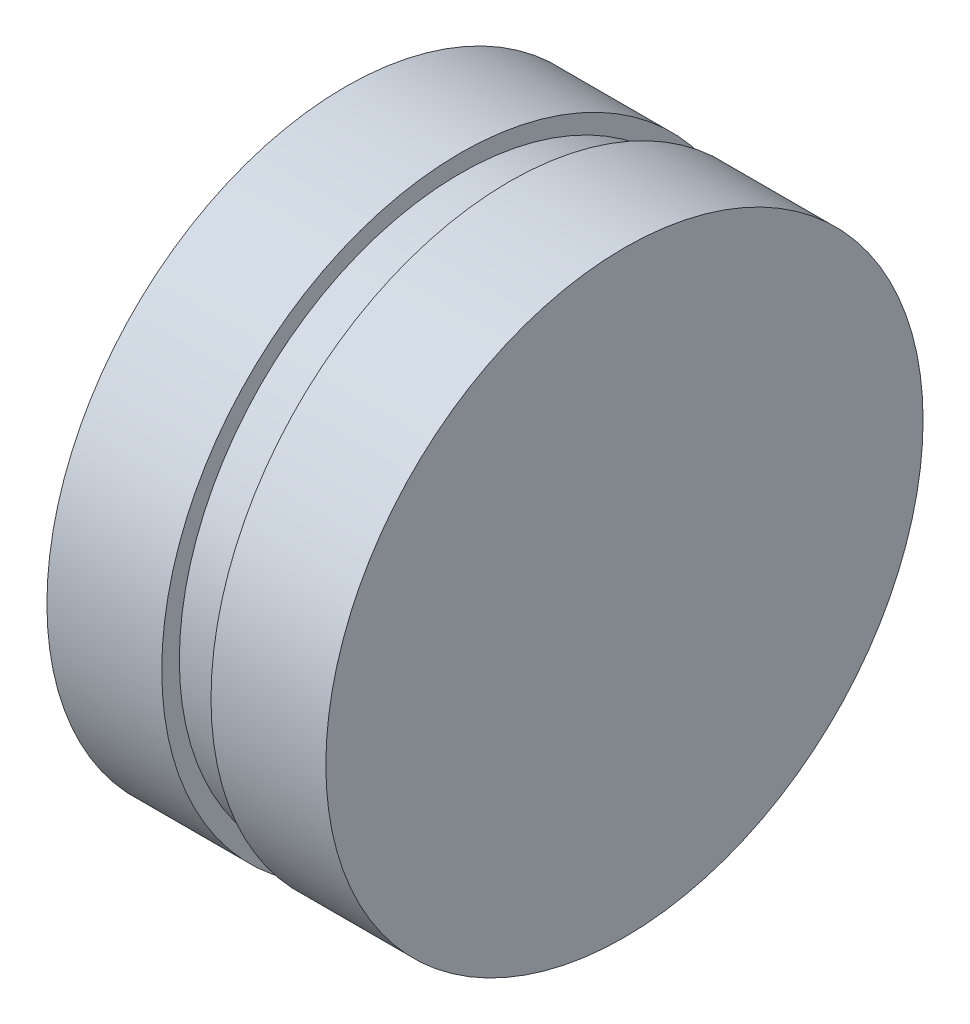
from build123d import *

# Parameters (mm, degrees)
SKETCH8_R           = 21.5646
BOSS_EXTRUDE1_DEPTH = 20.1422
SKETCH9_W           = 3.556
SKETCH9_H           = 1.27


with BuildPart() as part:
    # Sketch8 → Boss-Extrude1 (new body)
    with BuildSketch(Plane(origin=(36.83, 0, 0), x_dir=(0, 0, -1), z_dir=(1, 0, 0))):
        Circle(SKETCH8_R)
    extrude(amount=BOSS_EXTRUDE1_DEPTH)

    # Sketch9 → O-Ring Groove 2-128ish (revolve, cut)
    with BuildSketch(Plane.XY, mode=Mode.PRIVATE) as o_ring_groove_2_128ish_sk:
        with Locations((46.9011, 20.9296)):
            Rectangle(SKETCH9_W, SKETCH9_H)
    revolve(o_ring_groove_2_128ish_sk.sketch.rotate(Axis((-14.406993702, 0, 0), (1, 0, 0)), 90), axis=Axis((-14.406993702, 0, 0), (1, 0, 0)), mode=Mode.SUBTRACT)


solid = part.part
